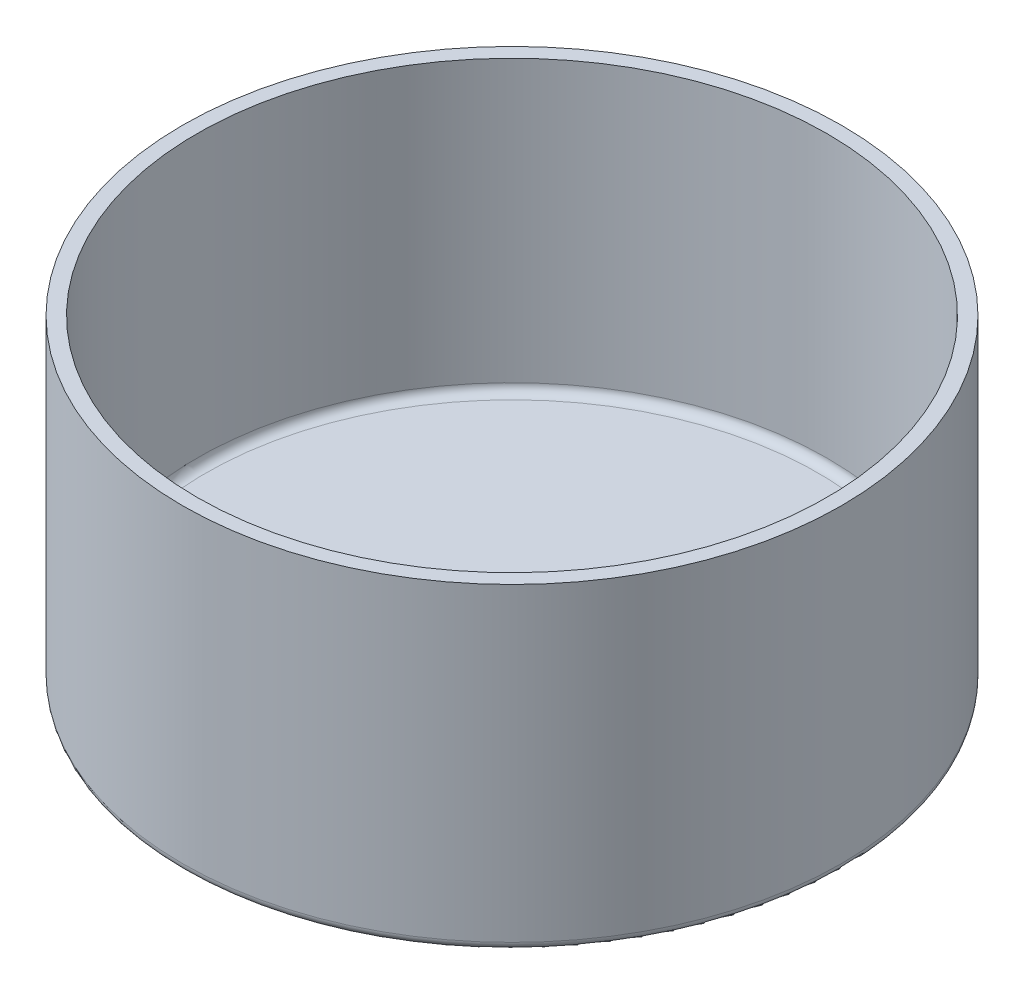
from build123d import *

# Parameters (mm, degrees)
CROQUIS1_R              = 11.375
SALIENTE_EXTRUIR1_DEPTH = 1
CROQUIS2_R              = 11.375
CROQUIS2_R_2            = 10.875
SALIENTE_EXTRUIR2_DEPTH = 10
REDONDEO1_R             = 0.3
REDONDEO2_R             = 0.3


with BuildPart() as part:
    # Croquis1 → Saliente-Extruir1 (new body)
    with BuildSketch(Plane(origin=(0, 0, 0), x_dir=(1, 0, 0), z_dir=(0, 1, 0))):
        with Locations(Location((0, 0, 0), (0, 0, 270))):
            Circle(CROQUIS1_R)
    extrude(amount=SALIENTE_EXTRUIR1_DEPTH)

    # Croquis2 → Saliente-Extruir2 (add)
    with BuildSketch(Plane(origin=(0, 1, 0), x_dir=(1, 0, 0), z_dir=(0, 1, 0))):
        with Locations(Location((0, 0, 0), (0, 0, 270))):
            Circle(CROQUIS2_R)
        with Locations(Location((0, 0, 0), (0, 0, 270))):
            Circle(CROQUIS2_R_2, mode=Mode.SUBTRACT)
    extrude(amount=SALIENTE_EXTRUIR2_DEPTH)

    # Redondeo1
    redondeo1_edges = [part.edges().sort_by_distance(p)[0] for p in [
        (0, 1, -10.875),
    ]]
    fillet(redondeo1_edges, radius=REDONDEO1_R)

    # Redondeo2
    redondeo2_edges = [part.edges().sort_by_distance(p)[0] for p in [
        (0, 0, -11.375),
    ]]
    fillet(redondeo2_edges, radius=REDONDEO2_R)


solid = part.part
